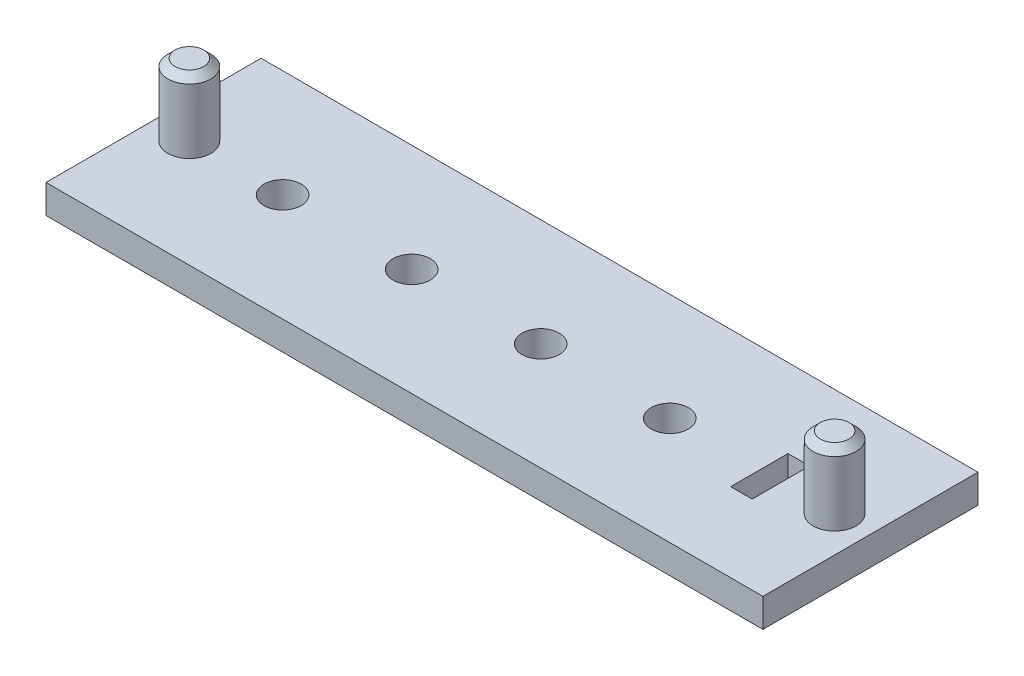
from build123d import *

# Parameters (mm, degrees)
CROQUIS1_W              = 50
CROQUIS1_H              = 15
CROQUIS1_R              = 1.3
CROQUIS1_W_2            = 1.5
CROQUIS1_H_2            = 4
SALIENTE_EXTRUIR1_DEPTH = 2
CROQUIS2_R              = 1.5
SALIENTE_EXTRUIR2_DEPTH = 5
CHAFL_N1_SIZE           = 0.5
CHAFL_N2_SIZE           = 0.5


with BuildPart() as part:
    # Croquis1 → Saliente-Extruir1 (new body)
    with BuildSketch(Plane(origin=(0, 0, 0), x_dir=(1, 0, 0), z_dir=(0, 1, 0))):
        Rectangle(CROQUIS1_W, CROQUIS1_H)
        with Locations(Location((-16, 0, 0), (0, 0, 270))):
            Circle(CROQUIS1_R, mode=Mode.SUBTRACT)
        with Locations(Location((-7, 0, 0), (0, 0, 270))):
            Circle(CROQUIS1_R, mode=Mode.SUBTRACT)
        with Locations(Location((2, 0, 0), (0, 0, 270))):
            Circle(CROQUIS1_R, mode=Mode.SUBTRACT)
        with Locations(Location((11, 0, 0), (0, 0, 270))):
            Circle(CROQUIS1_R, mode=Mode.SUBTRACT)
        with Locations((18, 0)):
            Rectangle(CROQUIS1_W_2, CROQUIS1_H_2, mode=Mode.SUBTRACT)
    extrude(amount=SALIENTE_EXTRUIR1_DEPTH)

    # Croquis2 → Saliente-Extruir2 (add)
    with BuildSketch(Plane(origin=(0, 2, 0), x_dir=(1, 0, 0), z_dir=(0, 1, 0))):
        with Locations(Location((-22.5, 0, 0), (0, 0, 90))):
            Circle(CROQUIS2_R)
        with Locations(Location((22.5, 0, 0), (0, 0, 90))):
            Circle(CROQUIS2_R)
    extrude(amount=SALIENTE_EXTRUIR2_DEPTH)

    # Chaflán1
    chafl_n1_edges = [part.edges().sort_by_distance(p)[0] for p in [
        (-22.5, 7, 1.5),
    ]]
    chamfer(chafl_n1_edges, length=CHAFL_N1_SIZE)

    # Chaflán2
    chafl_n2_edges = [part.edges().sort_by_distance(p)[0] for p in [
        (22.5, 7, 1.5),
    ]]
    chamfer(chafl_n2_edges, length=CHAFL_N2_SIZE)


solid = part.part
